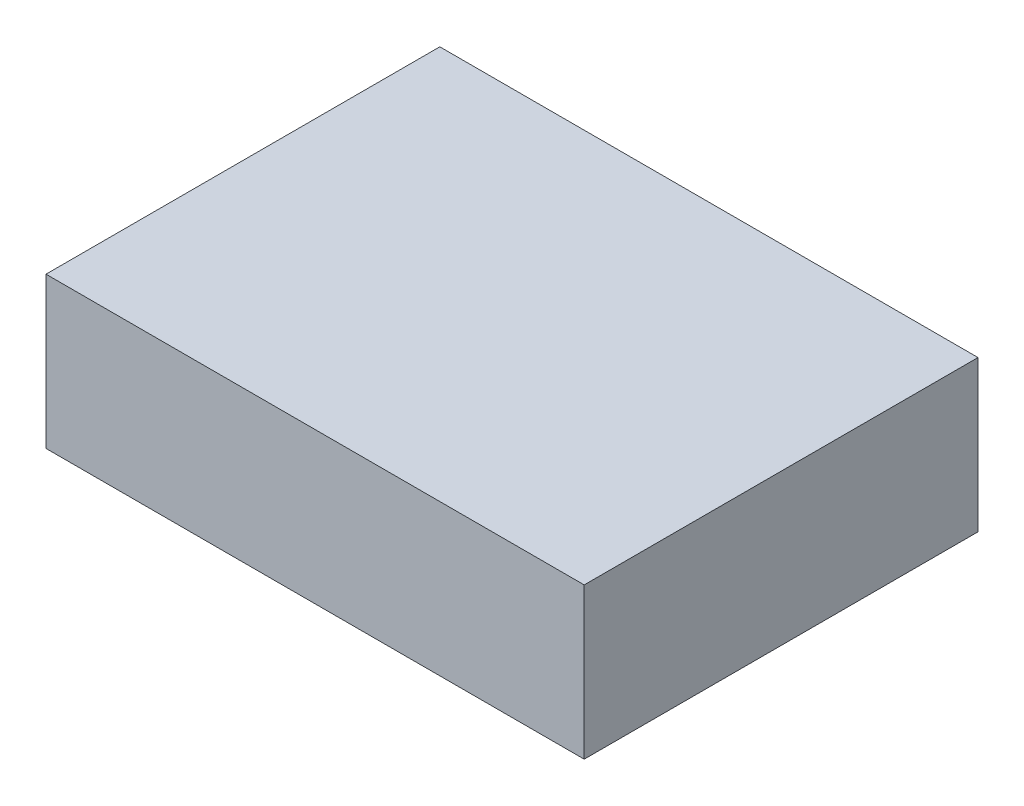
from build123d import *

# Parameters (mm, degrees)
SKETCH1_W           = 4.1
SKETCH1_H           = 3
BOSS_EXTRUDE1_DEPTH = 1.15
SKETCH2_R           = 0.15
BOSS_EXTRUDE2_DEPTH = 0.1


with BuildPart() as part:
    # Sketch1 → Boss-Extrude1 (new body)
    with BuildSketch(Plane(origin=(0, 0, 0), x_dir=(1, 0, 0), z_dir=(0, 1, 0))):
        with Locations((2.05, 1.5)):
            Rectangle(SKETCH1_W, SKETCH1_H)
    extrude(amount=BOSS_EXTRUDE1_DEPTH)


with BuildPart() as body_2:
    # Sketch2 → Boss-Extrude2 (new body)
    with BuildSketch(Plane(origin=(0, 0.74, 0), x_dir=(1, 0, 0), z_dir=(0, 1, 0))):
        with Locations(Location((2.05, 2.29, 0), (0, 0, 270))):
            Circle(SKETCH2_R)
    extrude(amount=-BOSS_EXTRUDE2_DEPTH)


solid = Compound([part.part, body_2.part])
